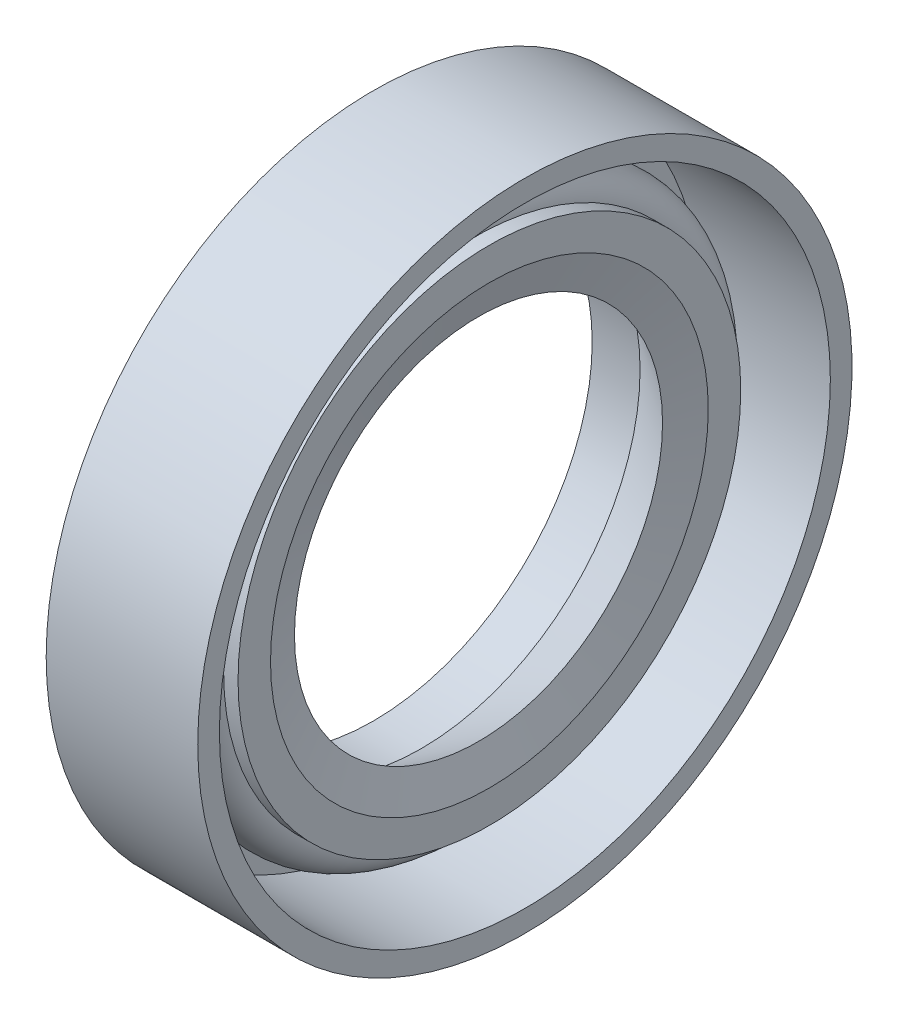
from build123d import *


with BuildPart() as part:
    # Sketch1 → Revolve1 (revolve)
    with BuildSketch(Plane.XY, mode=Mode.PRIVATE) as revolve1_sk:
        with BuildLine():
            Line((0, 15.10872808), (7, 15.10872808))
            Line((7, 15.10872808), (7, 14.10872808))
            Line((7, 14.10872808), (1, 14.10872808))
            Line((1, 14.10872808), (1, 11.60872808))
            Line((1, 11.60872808), (2.212243264, 11.60872808))
            ThreePointArc((2.212243264, 11.60872808), (3.453929748, 12.850414563), (4.695616231, 11.60872808))
            Line((4.695616231, 11.60872808), (5.360797146, 11.60872808))
            Line((5.360797146, 11.60872808), (5.360797146, 10.10872808))
            Line((5.360797146, 10.10872808), (4.858192306, 8.5))
            Line((4.858192306, 8.5), (2.212243264, 10.10872808))
            Line((2.212243264, 10.10872808), (0, 10.10872808))
            Line((0, 10.10872808), (0, 15.10872808))
        make_face()
    revolve(revolve1_sk.sketch.rotate(Axis((0, 0, 0), (1, 0, 0)), 90), axis=Axis((0, 0, 0), (1, 0, 0)))


solid = part.part
